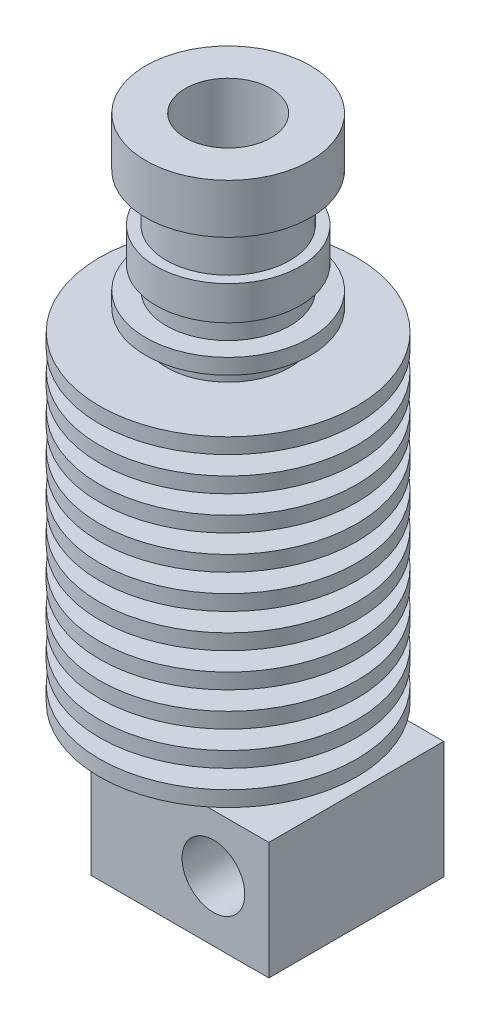
from build123d import *

# Parameters (mm, degrees)
SKETCH2_R           = 4.159262234
CUT_EXTRUDE1_DEPTH  = 10
SKETCH3_W           = 17.293974885
SKETCH3_H           = 11.410212081
BOSS_EXTRUDE1_DEPTH = 8.5
SKETCH4_R           = 3.04865438
CUT_EXTRUDE2_DEPTH  = 17


with BuildPart() as part:
    # Sketch1 → Revolve1 (revolve)
    with BuildSketch(Plane.XY, mode=Mode.PRIVATE) as revolve1_sk:
        Polygon((-2, -15.925549295), (-2, -28.816393339), (-4, -28.816393339), (-4, -32.836590434), (-0.942955999, -34.998102919), (-0.25, -34.998102919), (-0.25, -33.674450705), (0, -33.674450705), (0, 33.674450705), (-8, 33.674450705), (-8, 28.874450705), (-6, 28.874450705), (-6, 24.274450705), (-7, 24.274450705), (-7, 20.974450705), (-6, 20.974450705), (-6, 18.774450705), (-8, 18.774450705), (-8, 17.274450705), (-6, 17.274450705), (-6, 15.274450705), (-12.5, 15.274450705), (-12.5, 13.774450705), (-7.5, 13.774450705), (-7.5, 11.974450705), (-12.5, 11.974450705), (-12.5, 10.474450705), (-7.5, 10.474450705), (-7.5, 8.674450705), (-12.5, 8.674450705), (-12.5, 7.174450705), (-7.5, 7.174450705), (-7.5, 5.374450705), (-12.5, 5.374450705), (-12.5, 3.874450705), (-7.5, 3.874450705), (-7.5, 2.074450705), (-12.5, 2.074450705), (-12.5, 0.574450705), (-7.5, 0.574450705), (-7.5, -1.225549295), (-12.5, -1.225549295), (-12.5, -2.725549295), (-7.5, -2.725549295), (-7.5, -4.525549295), (-12.5, -4.525549295), (-12.5, -6.025549295), (-7.5, -6.025549295), (-7.5, -7.825549295), (-12.5, -7.825549295), (-12.5, -9.325549295), (-7.5, -9.325549295), (-7.5, -11.125549295), (-12.5, -11.125549295), (-12.5, -12.625549295), (-7.5, -12.625549295), (-7.5, -14.425549295), (-12.5, -14.425549295), (-12.5, -15.925549295), align=None)
    revolve(revolve1_sk.sketch.rotate(Axis((0, -1005.655436074, 0), (0, 1, 0)), 270), axis=Axis((0, -1005.655436074, 0), (0, 1, 0)))

    # Sketch2 → Cut-Extrude1 (cut)
    with BuildSketch(Plane(origin=(0, 33.674450705, 0), x_dir=(1, 0, 0), z_dir=(0, 1, 0))):
        with Locations(Location((0, 0, 0), (0, 0, 270))):
            Circle(SKETCH2_R)
    extrude(amount=-CUT_EXTRUDE1_DEPTH, mode=Mode.SUBTRACT)

    # Sketch3 → Boss-Extrude1 (add, symmetric)
    with BuildSketch(Plane.XY):
        with Locations((3.80447813, -22.923519592)):
            Rectangle(SKETCH3_W, SKETCH3_H)
    extrude(amount=BOSS_EXTRUDE1_DEPTH, both=True)

    # Sketch4 → Cut-Extrude2 (cut)
    with BuildSketch(Plane.XY.offset(8.5)):
        with Locations((7.066076907, -22.750382856)):
            Circle(SKETCH4_R)
    extrude(amount=-CUT_EXTRUDE2_DEPTH, mode=Mode.SUBTRACT)


solid = part.part
